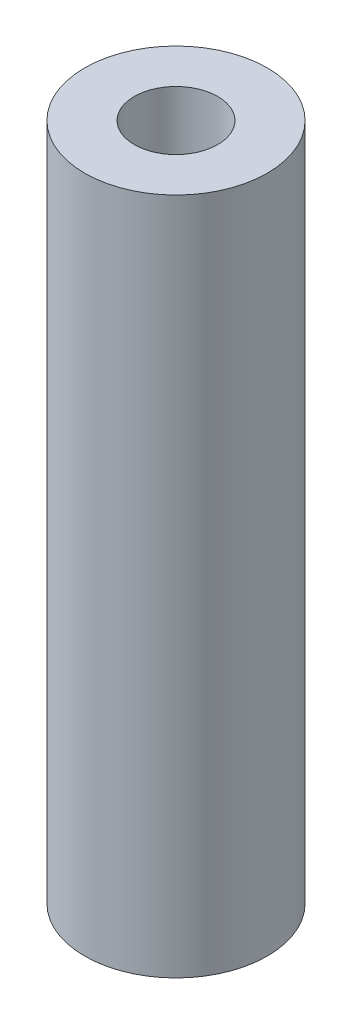
from build123d import *

# Parameters (mm, degrees)
SKETCH1_R           = 3.5
SKETCH1_R_2         = 1.6
BOSS_EXTRUDE1_DEPTH = 26


with BuildPart() as part:
    # Sketch1 → Boss-Extrude1 (new body)
    with BuildSketch(Plane(origin=(0, 0, 0), x_dir=(1, 0, 0), z_dir=(0, 1, 0))):
        with Locations(Location((0, 0, 0), (0, 0, 90))):
            Circle(SKETCH1_R)
        with Locations(Location((0, 0, 0), (0, 0, 90))):
            Circle(SKETCH1_R_2, mode=Mode.SUBTRACT)
    extrude(amount=BOSS_EXTRUDE1_DEPTH)


solid = part.part
